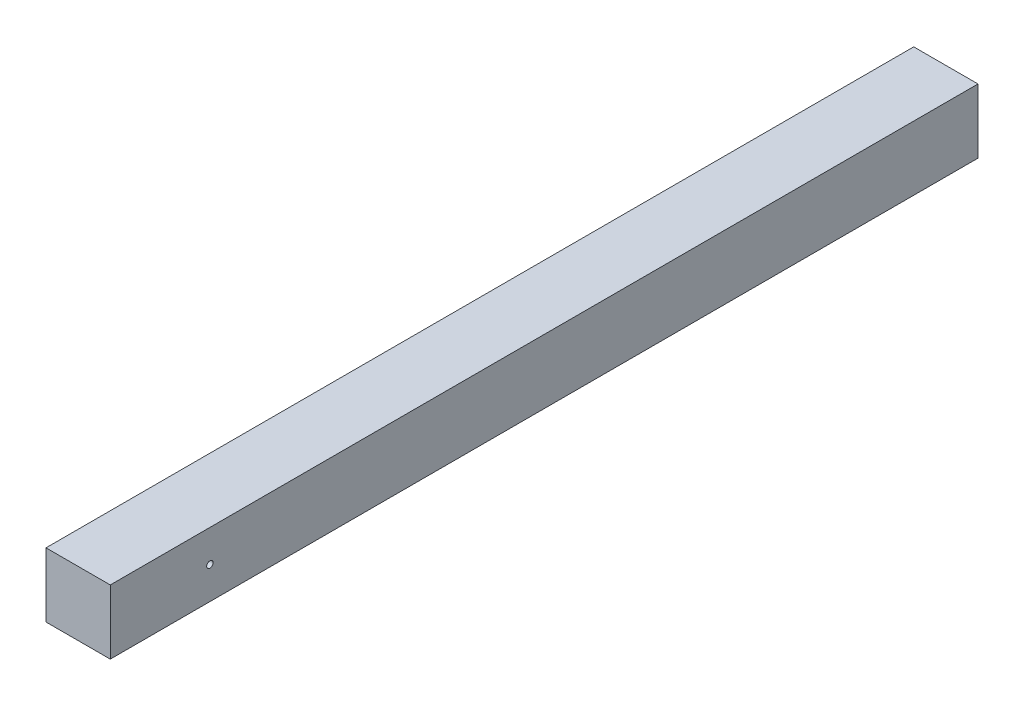
from build123d import *

# Parameters (mm, degrees)
SKETCH1_W           = 100
SKETCH1_H           = 100
BOSS_EXTRUDE1_DEPTH = 675
SKETCH2_R           = 5
CUT_EXTRUDE1_DEPTH  = 685.19660917


with BuildPart() as part:
    # Sketch1 → Boss-Extrude1 (new, symmetric)
    with BuildSketch(Plane.XY):
        Rectangle(SKETCH1_W, SKETCH1_H)
    extrude(amount=BOSS_EXTRUDE1_DEPTH, both=True)

    # Sketch2 → Cut-Extrude1 (cut, through all)
    with BuildSketch(Plane.ZY.offset(50)):
        with Locations((520, 0)):
            Circle(SKETCH2_R)
    extrude(amount=-CUT_EXTRUDE1_DEPTH, mode=Mode.SUBTRACT)


solid = part.part
